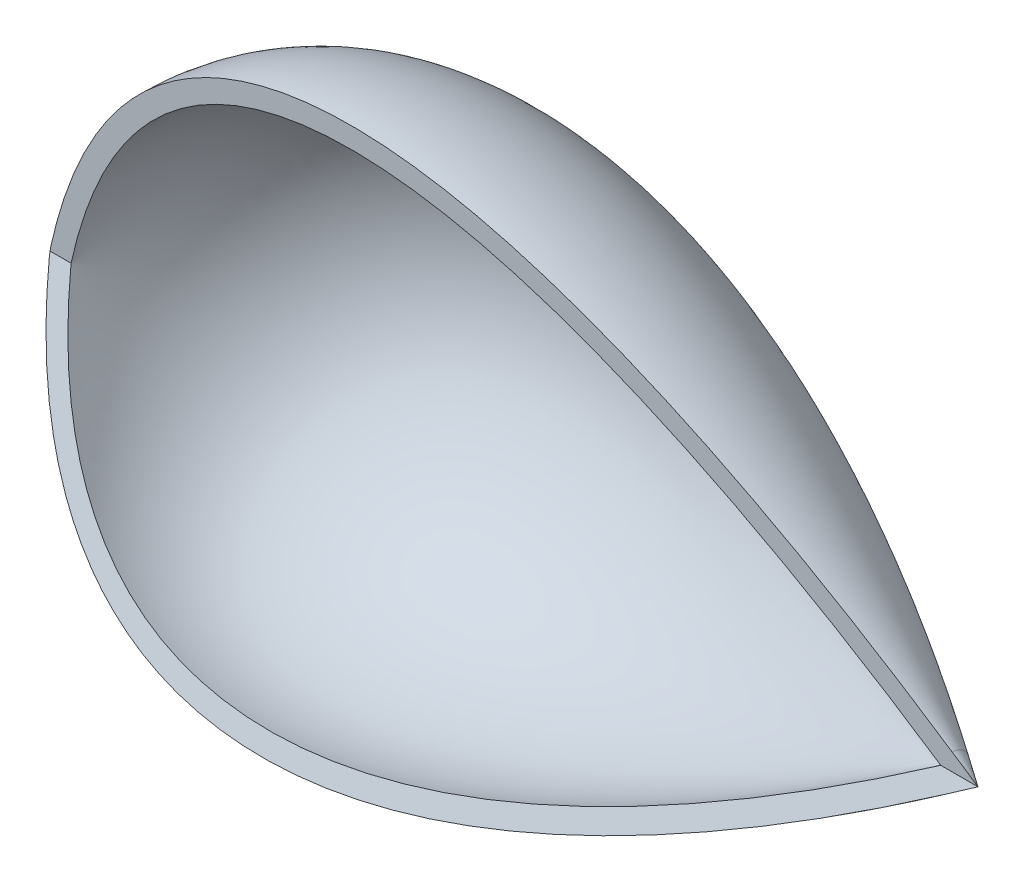
from build123d import *

# Parameters (mm, degrees)
REVOLVE1_ANGLE = 200


with BuildPart() as part:
    # Sketch2 → Revolve1 (revolve)
    with BuildSketch(Plane.XY):
        with BuildLine():
            Line((-3.212655458, 0), (0, 0))
            add(Edge.make_bspline(
                [(0, 0), (12.266597433, 55.565385953), (71.285750956, 41.492227614), (133.35, 0)],
                knots=[0, 0, 0, 0, 1, 1, 1, 1], degree=3))
            Line((133.35, 0), (139.062733179, 0))
            Line((139.062733179, 0), (135.114588803, 2.639479372))
            add(Edge.make_bspline(
                [(-3.100351122, 0.684432556), (-2.903904755, 1.574297755), (-2.476919946, 3.365605775), (-1.536324421, 6.773085244), (-0.176603867, 10.808607442), (1.739087424, 15.266159853), (4.669427281, 20.711540733), (9.025527184, 26.582284091), (15.29209378, 32.11737273), (22.470757612, 36.136231388), (33.062954869, 39.535038693), (47.899352208, 40.345946179), (64.401664411, 37.242836845), (78.412884844, 32.721878401), (89.272437749, 28.378018543), (100.429620724, 23.145710859), (111.824851295, 17.089521742), (121.478569851, 11.402427952), (129.247941257, 6.511575904), (133.174021898, 3.936819547), (135.114588803, 2.639479372)],
                knots=[0, 0, 0, 0, 0.015625, 0.03125, 0.0625, 0.09375, 0.125, 0.1875, 0.25, 0.3125, 0.375, 0.5, 0.625, 0.6875, 0.75, 0.8125, 0.875, 0.9375, 0.96875, 1, 1, 1, 1], degree=3))
            ThreePointArc((-3.100351122, 0.684432556), (-3.165854996, 0.343750742), (-3.212655458, 0))
        make_face()
    revolve(axis=Axis((79.375, 0, 0), (-1, 0, 0)), revolution_arc=REVOLVE1_ANGLE)


solid = part.part
